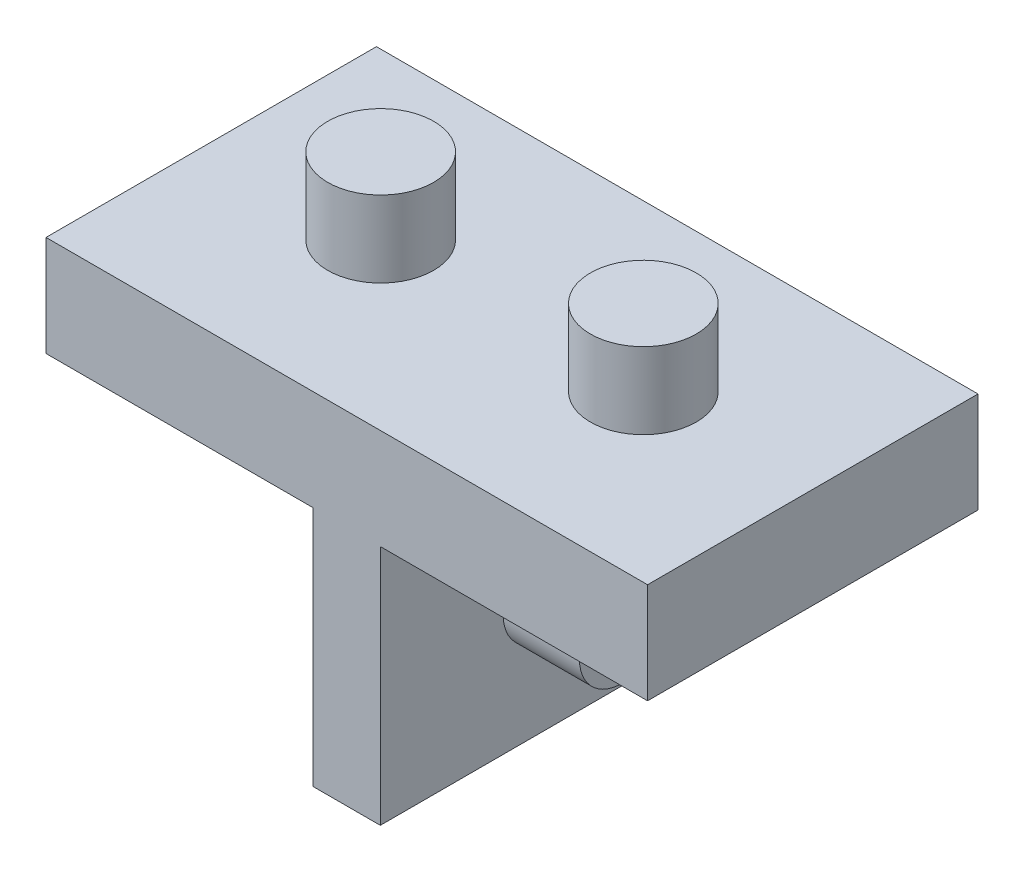
from build123d import *

# Parameters (mm, degrees)
SALIENTE_EXTRUIR1_DEPTH = 11.7
CROQUIS3_R              = 3.75
SALIENTE_EXTRUIR2_DEPTH = 5.4
CROQUIS5_R              = 3
SALIENTE_EXTRUIR3_DEPTH = 5.4


with BuildPart() as part:
    # Croquis2 → Saliente-Extruir1 (new, symmetric)
    with BuildSketch(Plane.XY):
        Polygon((-21.3, 7.12), (-21.3, 0), (-2.375, 0), (-2.375, -17.1), (2.375, -17.1), (2.375, 0), (21.3, 0), (21.3, 7.12), align=None)
    extrude(amount=SALIENTE_EXTRUIR1_DEPTH, both=True)

    # Croquis3 → Saliente-Extruir2 (add)
    with BuildSketch(Plane(origin=(0, 7.12, 0), x_dir=(1, 0, 0), z_dir=(0, 1, 0))):
        with Locations((-9.3, 0)):
            Circle(CROQUIS3_R)
        with Locations((9.3, 0)):
            Circle(CROQUIS3_R)
    extrude(amount=SALIENTE_EXTRUIR2_DEPTH)

    # Croquis5 → Saliente-Extruir3 (add)
    with BuildSketch(Plane(origin=(2.375, 0, 0), x_dir=(0, 0, -1), z_dir=(1, 0, 0))):
        with Locations(Location((0, -8.55, 0), (0, 0, 180))):
            Circle(CROQUIS5_R)
    saliente_extruir3 = extrude(amount=SALIENTE_EXTRUIR3_DEPTH)

    # Simetría1: Saliente-Extruir3 across plane
    add(saliente_extruir3.mirror(Plane(origin=(0, 0, 0), x_dir=(0, 0, 1), z_dir=(1, 0, 0))))


solid = part.part
